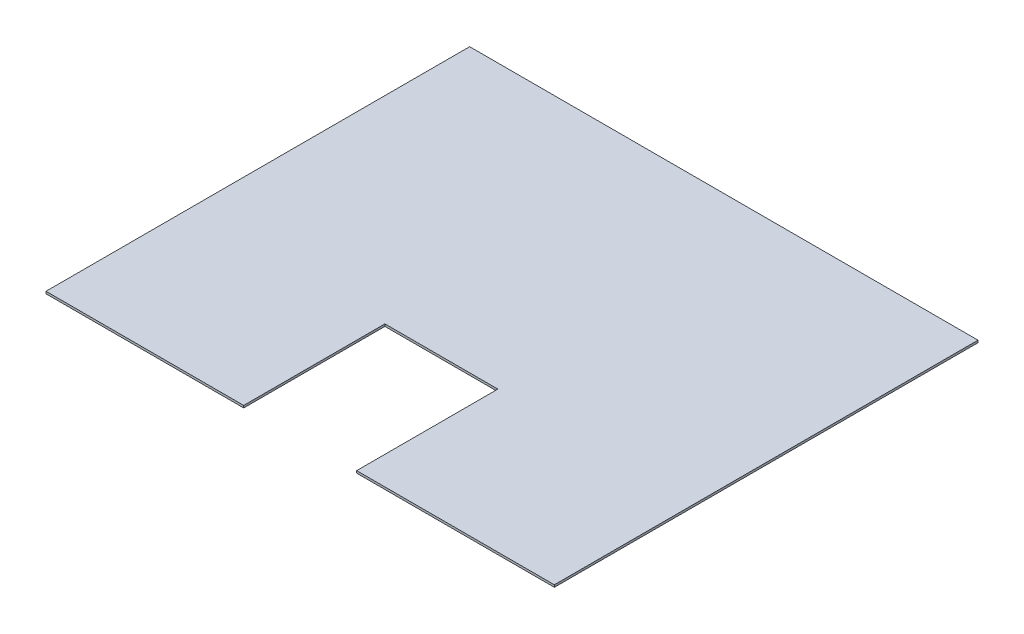
from build123d import *

# Parameters (mm, degrees)
SKETCH1_W           = 457.2
SKETCH1_H           = 381
BOSS_EXTRUDE1_DEPTH = 2
SKETCH120_W         = 101.6
SKETCH120_H         = 127
CUT_EXTRUDE2_DEPTH  = 298.577233672


with BuildPart() as part:
    # Sketch1 → Boss-Extrude1 (new body)
    with BuildSketch(Plane(origin=(0, 0, 0), x_dir=(1, 0, 0), z_dir=(0, 1, 0))):
        Rectangle(SKETCH1_W, SKETCH1_H)
    extrude(amount=BOSS_EXTRUDE1_DEPTH)

    # Sketch120 → Cut-Extrude2 (cut, through all)
    with BuildSketch(Plane(origin=(0, 2, 0), x_dir=(1, 0, 0), z_dir=(0, 1, 0))):
        with Locations((0, -127)):
            Rectangle(SKETCH120_W, SKETCH120_H)
    extrude(amount=-CUT_EXTRUDE2_DEPTH, mode=Mode.SUBTRACT)


solid = part.part
